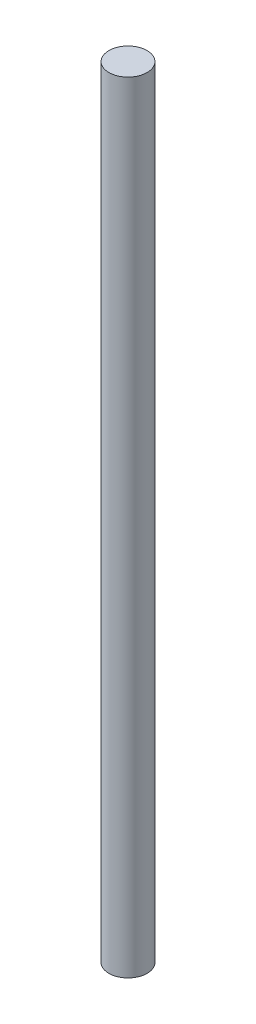
from build123d import *

# Parameters (mm, degrees)
SKETCH_1_R      = 35
EXTRUDE_1_DEPTH = 1432


with BuildPart() as part:
    # 草图1 → 凸台-拉伸1 (new body)
    with BuildSketch(Plane(origin=(0, 0, 0), x_dir=(1, 0, 0), z_dir=(0, 1, 0))):
        with Locations(Location((0, 0, 0), (0, 0, 90))):
            Circle(SKETCH_1_R)
    extrude(amount=EXTRUDE_1_DEPTH)


solid = part.part
